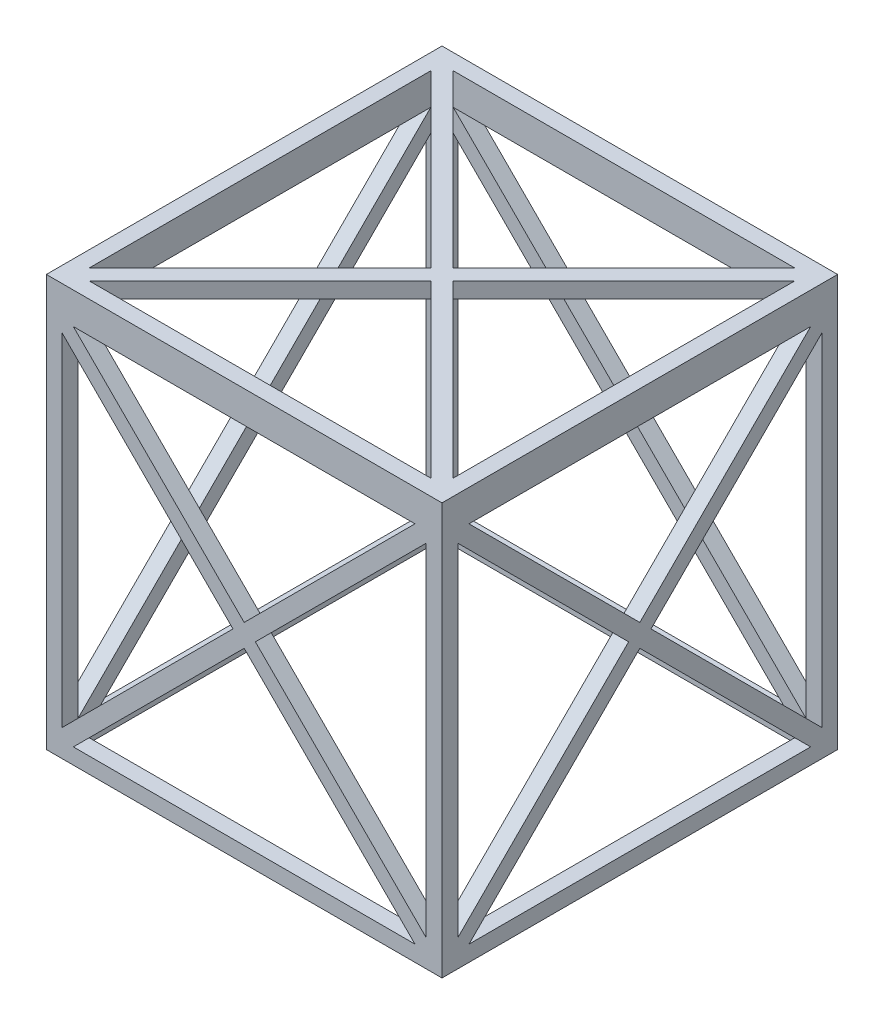
from build123d import *

# Parameters (mm, degrees)
SKETCH1_W           = 100
SKETCH1_H           = 100
BOSS_EXTRUDE1_DEPTH = 4
SKETCH9_W           = 100
SKETCH9_H           = 100
BOSS_EXTRUDE2_DEPTH = 4
SKETCH10_W          = 100
SKETCH10_H          = 100
BOSS_EXTRUDE3_DEPTH = 4


with BuildPart() as part:
    # Sketch1 → Boss-Extrude1 (new body)
    with BuildSketch(Plane.XY.offset(50)):
        Rectangle(SKETCH1_W, SKETCH1_H)
        Polygon((-43.171572875, 46), (43.171572875, 46), (0, 2.828427125), align=None, mode=Mode.SUBTRACT)
        Polygon((46, -43.171572875), (46, 43.171572875), (2.828427125, 0), align=None, mode=Mode.SUBTRACT)
        Polygon((-43.171572875, -46), (43.171572875, -46), (0, -2.828427125), align=None, mode=Mode.SUBTRACT)
        Polygon((-46, -43.171572875), (-46, 43.171572875), (-2.828427125, 0), align=None, mode=Mode.SUBTRACT)
    extrude(amount=-BOSS_EXTRUDE1_DEPTH)


with BuildPart() as body_2:
    # Mirror2: mirrored copy
    add(part.part.mirror(Plane.XY))


with BuildPart() as part_1:
    add(part.part)

    add(body_2.part)  # Boss-Extrude2 merges body 2
    # Sketch9 → Boss-Extrude2 (add)
    with BuildSketch(Plane(origin=(50, 0, 0), x_dir=(0, 0, -1), z_dir=(1, 0, 0))):
        Rectangle(SKETCH9_W, SKETCH9_H)
        Polygon((43.171572875, 46), (-43.171572875, 46), (0, 2.828427125), align=None, mode=Mode.SUBTRACT)
        Polygon((-46, -43.171572875), (-46, 43.171572875), (-2.828427125, 0), align=None, mode=Mode.SUBTRACT)
        Polygon((43.171572875, -46), (-43.171572875, -46), (0, -2.828427125), align=None, mode=Mode.SUBTRACT)
        Polygon((46, -43.171572875), (46, 43.171572875), (2.828427125, 0), align=None, mode=Mode.SUBTRACT)
    boss_extrude2 = extrude(amount=-BOSS_EXTRUDE2_DEPTH)

    # Mirror3: Boss-Extrude2 across plane
    add(boss_extrude2.mirror(Plane(origin=(0, 0, 0), x_dir=(0, 0, 1), z_dir=(1, 0, 0))))

    # Sketch10 → Boss-Extrude3 (add)
    with BuildSketch(Plane(origin=(0, 50, 0), x_dir=(1, 0, 0), z_dir=(0, 1, 0))):
        Rectangle(SKETCH10_W, SKETCH10_H)
        Polygon((-46, -43.171572875), (-46, 43.171572875), (-2.828427125, 0), align=None, mode=Mode.SUBTRACT)
        Polygon((-43.171572875, 46), (43.171572875, 46), (0, 2.828427125), align=None, mode=Mode.SUBTRACT)
        Polygon((46, -43.171572875), (46, 43.171572875), (2.828427125, 0), align=None, mode=Mode.SUBTRACT)
        Polygon((-43.171572875, -46), (43.171572875, -46), (0, -2.828427125), align=None, mode=Mode.SUBTRACT)
    extrude(amount=BOSS_EXTRUDE3_DEPTH)


solid = part_1.part
